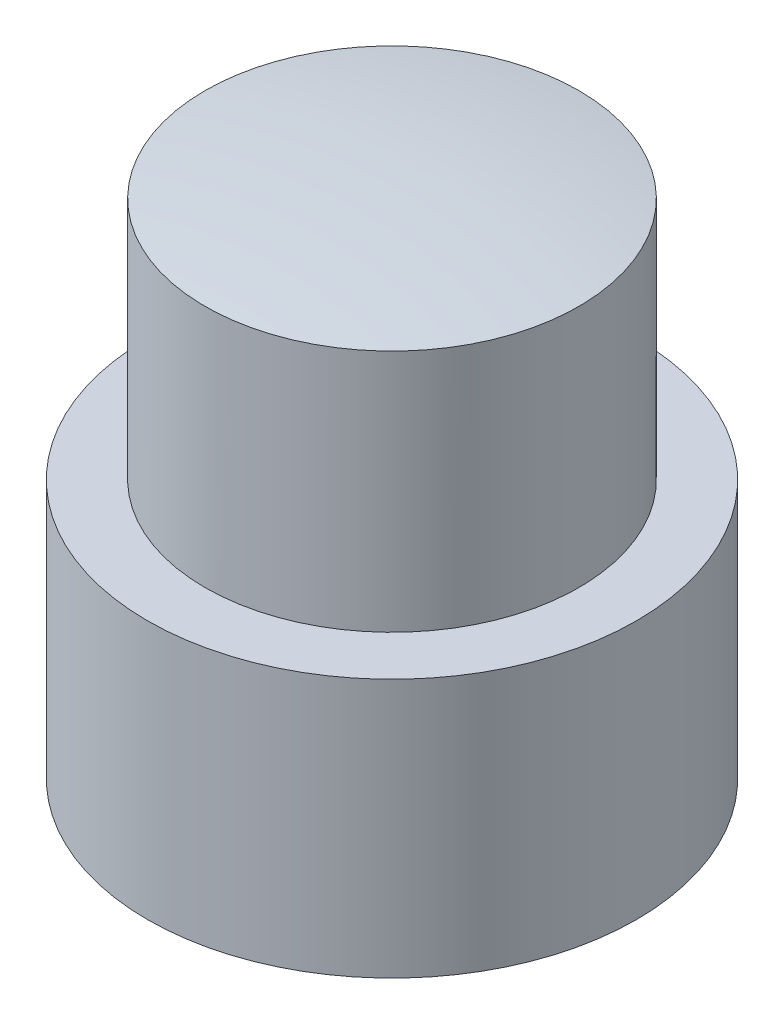
from build123d import *


with BuildPart() as part:
    # Sketch1 → Revolve1 (revolve)
    with BuildSketch(Plane.XY, mode=Mode.PRIVATE) as revolve1_sk:
        with BuildLine():
            Line((-1.75, 0), (-1.75, 2))
            Line((-1.75, 2), (0, 2))
            Line((0, 2), (0, 9))
            ThreePointArc((0, 9), (-1.630426718, 8.933431935), (-3.25, 8.734170872))
            Line((-3.25, 8.734170872), (-3.25, 4.5))
            Line((-3.25, 4.5), (-4.25, 4.5))
            Line((-4.25, 4.5), (-4.25, 0))
            Line((-4.25, 0), (-1.75, 0))
        make_face()
    revolve(revolve1_sk.sketch.rotate(Axis((0, 2, 0), (0, 1, 0)), 270), axis=Axis((0, 2, 0), (0, 1, 0)))


solid = part.part
